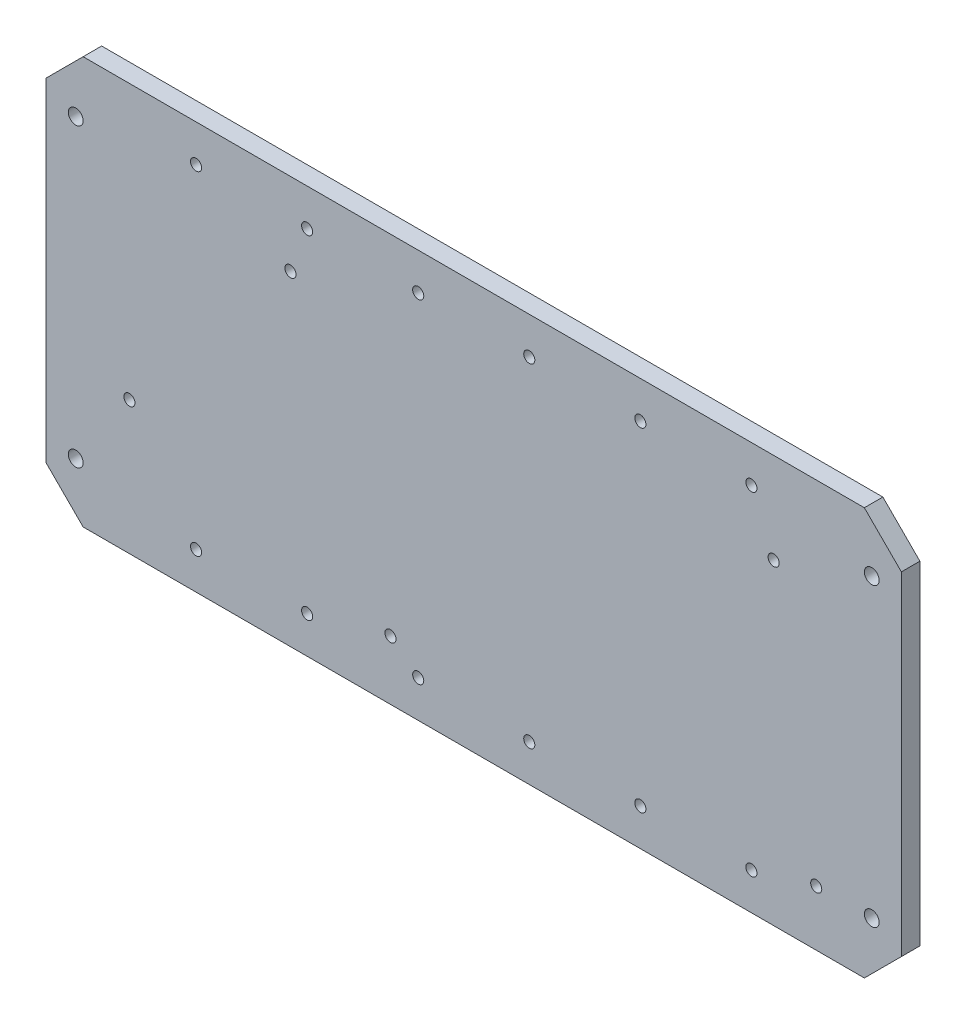
from build123d import *

# Parameters (mm, degrees)
SKETCH1_W           = 231
SKETCH1_H           = 110
SKETCH1_R           = 1.5
SKETCH1_R_2         = 2
BOSS_EXTRUDE1_DEPTH = 5
CHAMFER1_SIZE       = 10


with BuildPart() as part:
    # Sketch1 → Boss-Extrude1 (new body)
    with BuildSketch(Plane.XY):
        with Locations((115.5, 55)):
            Rectangle(SKETCH1_W, SKETCH1_H)
        with Locations((196.5, 85.5)):
            Circle(SKETCH1_R, mode=Mode.SUBTRACT)
        with Locations((93, 16)):
            Circle(SKETCH1_R, mode=Mode.SUBTRACT)
        with Locations((66, 87.8)):
            Circle(SKETCH1_R, mode=Mode.SUBTRACT)
        with Locations((22.5, 36)):
            Circle(SKETCH1_R, mode=Mode.SUBTRACT)
        with Locations((223, 95)):
            Circle(SKETCH1_R_2, mode=Mode.SUBTRACT)
        with Locations((223, 15)):
            Circle(SKETCH1_R_2, mode=Mode.SUBTRACT)
        with Locations(Location((8, 95, 0), (0, 0, 180))):
            Circle(SKETCH1_R_2, mode=Mode.SUBTRACT)
        with Locations(Location((8, 15, 0), (0, 0, 180))):
            Circle(SKETCH1_R_2, mode=Mode.SUBTRACT)
        with Locations((208, 15)):
            Circle(SKETCH1_R, mode=Mode.SUBTRACT)
        with Locations((130.5, 100)):
            Circle(SKETCH1_R, mode=Mode.SUBTRACT)
        with Locations((160.5, 100)):
            Circle(SKETCH1_R, mode=Mode.SUBTRACT)
        with Locations((190.5, 100)):
            Circle(SKETCH1_R, mode=Mode.SUBTRACT)
        with Locations(Location((40.5, 100, 0), (0, 0, 180))):
            Circle(SKETCH1_R, mode=Mode.SUBTRACT)
        with Locations(Location((70.5, 100, 0), (0, 0, 180))):
            Circle(SKETCH1_R, mode=Mode.SUBTRACT)
        with Locations(Location((100.5, 100, 0), (0, 0, 180))):
            Circle(SKETCH1_R, mode=Mode.SUBTRACT)
        with Locations((100.5, 10)):
            Circle(SKETCH1_R, mode=Mode.SUBTRACT)
        with Locations((70.5, 10)):
            Circle(SKETCH1_R, mode=Mode.SUBTRACT)
        with Locations((40.5, 10)):
            Circle(SKETCH1_R, mode=Mode.SUBTRACT)
        with Locations(Location((190.5, 10, 0), (0, 0, 180))):
            Circle(SKETCH1_R, mode=Mode.SUBTRACT)
        with Locations(Location((160.5, 10, 0), (0, 0, 180))):
            Circle(SKETCH1_R, mode=Mode.SUBTRACT)
        with Locations(Location((130.5, 10, 0), (0, 0, 180))):
            Circle(SKETCH1_R, mode=Mode.SUBTRACT)
    extrude(amount=BOSS_EXTRUDE1_DEPTH)

    # Chamfer1
    chamfer1_edges = [part.edges().sort_by_distance(p)[0] for p in [
        (0, 110, 2.5),
        (231, 110, 2.5),
        (231, 0, 2.5),
        (0, 0, 2.5),
    ]]
    chamfer(chamfer1_edges, length=CHAMFER1_SIZE)


solid = part.part
